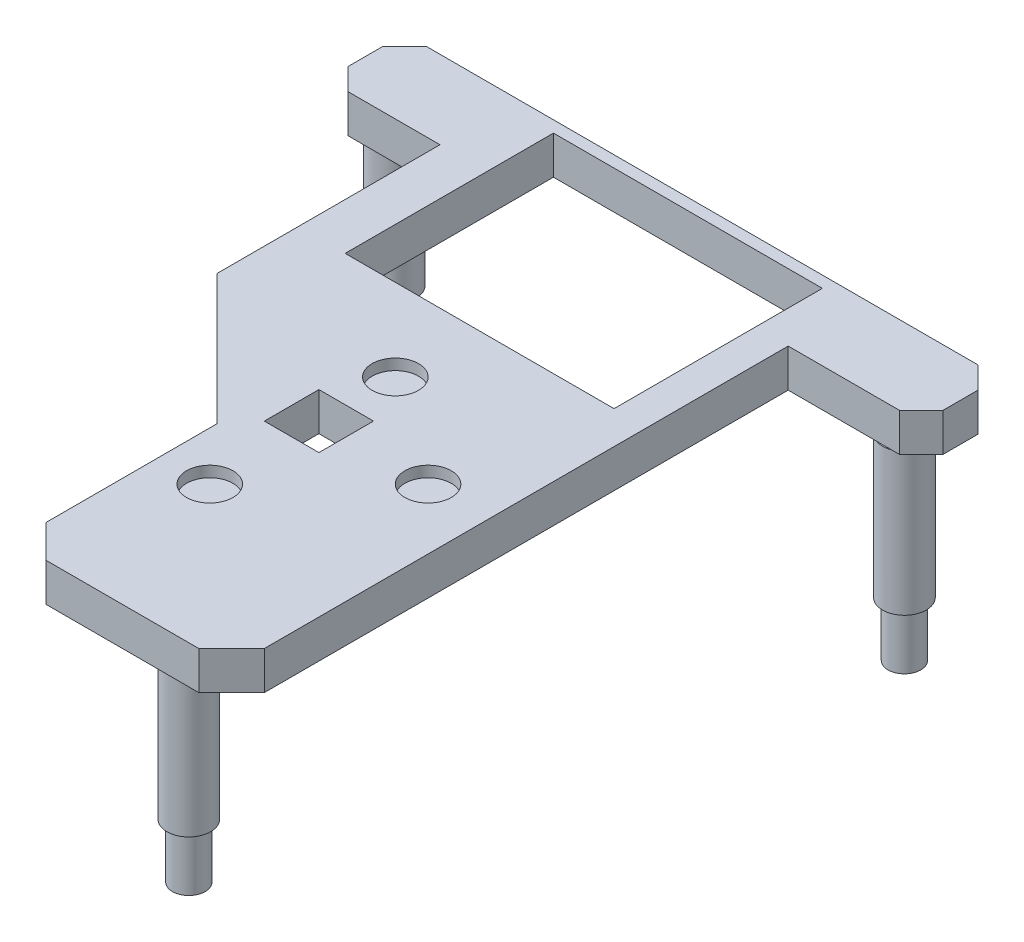
from build123d import *

# Parameters (mm, degrees)
SKETCH4_W           = 24.633837396
SKETCH4_H           = 19.082768461
SKETCH4_W_2         = 5
SKETCH4_H_2         = 5
MAINBRACKET_DEPTH   = 3.5
SKETCH3_R           = 2
BOSS_EXTRUDE2_DEPTH = 13
SKETCH6_R           = 1.5
BOSS_EXTRUDE3_DEPTH = 5
SKETCH7_R           = 2.125
CUT_EXTRUDE1_DEPTH  = 1


with BuildPart() as part:
    # Sketch4 → MainBracket (new body)
    with BuildSketch(Plane(origin=(0, 0, 0), x_dir=(1, 0, 0), z_dir=(0, 1, 0))):
        Polygon((-25.001052975, 23.597895529), (25.52718448, 23.597895529), (27.52718448, 21.597895529), (27.52718448, 18.397895529), (25.52718448, 16.397895529), (15.338231538, 16.397895529), (15.338231538, -31.590979949), (12.338231538, -34.590979949), (-1.661768462, -34.590979949), (-4.661768462, -31.590979949), (-4.661768462, -15.921260677), (-16.583029139, -4), (-16.583029139, 16.421906692), (-25.001052975, 16.421906692), (-27.001052975, 18.421906692), (-27.001052975, 21.597895529), align=None)
        with Locations((0.008956485, 13.000441896)):
            Rectangle(SKETCH4_W, SKETCH4_H, mode=Mode.SUBTRACT)
        with Locations((-0.204070078, -11.047717724)):
            Rectangle(SKETCH4_W_2, SKETCH4_H_2, mode=Mode.SUBTRACT)
    extrude(amount=MAINBRACKET_DEPTH)

    # Sketch3 → Boss-Extrude2 (add)
    with BuildSketch(Plane(origin=(0, 0, 0), x_dir=(1, 0, 0), z_dir=(0, 1, 0))):
        with Locations((-24.011269627, 19.663273311)):
            Circle(SKETCH3_R)
        with Locations((24.107482847, 18.27469294)):
            Circle(SKETCH3_R)
        with Locations((8.917908931, -32.088026328)):
            Circle(SKETCH3_R)
    extrude(amount=-BOSS_EXTRUDE2_DEPTH)

    # Sketch6 → Boss-Extrude3 (add)
    with BuildSketch(Plane.XZ.offset(13)):
        with Locations((-24.011269627, -19.663273311)):
            Circle(SKETCH6_R)
        with Locations((8.917908931, 32.088026328)):
            Circle(SKETCH6_R)
        with Locations((24.107482847, -18.27469294)):
            Circle(SKETCH6_R)
    extrude(amount=BOSS_EXTRUDE3_DEPTH)

    # Sketch7 → Cut-Extrude1 (cut)
    with BuildSketch(Plane(origin=(0, 3.5, 0), x_dir=(1, 0, 0), z_dir=(0, 1, 0))):
        with Locations((-0.204070078, -21.047717724)):
            Circle(SKETCH7_R)
        with Locations((-0.204070078, -4.047717724)):
            Circle(SKETCH7_R)
        with Locations((9.795929922, -11.047717724)):
            Circle(SKETCH7_R)
    extrude(amount=-CUT_EXTRUDE1_DEPTH, mode=Mode.SUBTRACT)


solid = part.part
